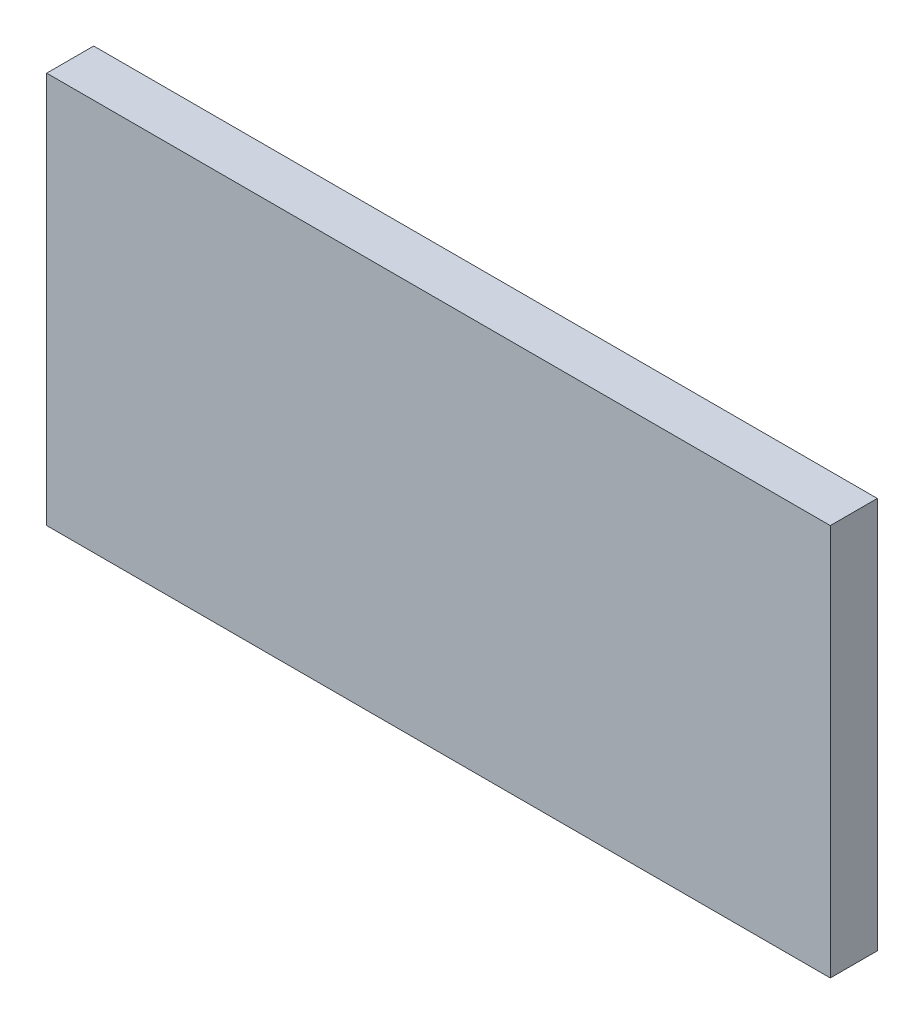
from build123d import *

# Parameters (mm, degrees)
ESBO_O1_W                = 300
ESBO_O1_H                = 150
RESSALTO_EXTRUS_O1_DEPTH = 18


with BuildPart() as part:
    # Esboço1 → Ressalto-extrusão1 (new body)
    with BuildSketch(Plane.XY):
        with Locations((150, 75)):
            Rectangle(ESBO_O1_W, ESBO_O1_H)
    extrude(amount=RESSALTO_EXTRUS_O1_DEPTH)


solid = part.part
